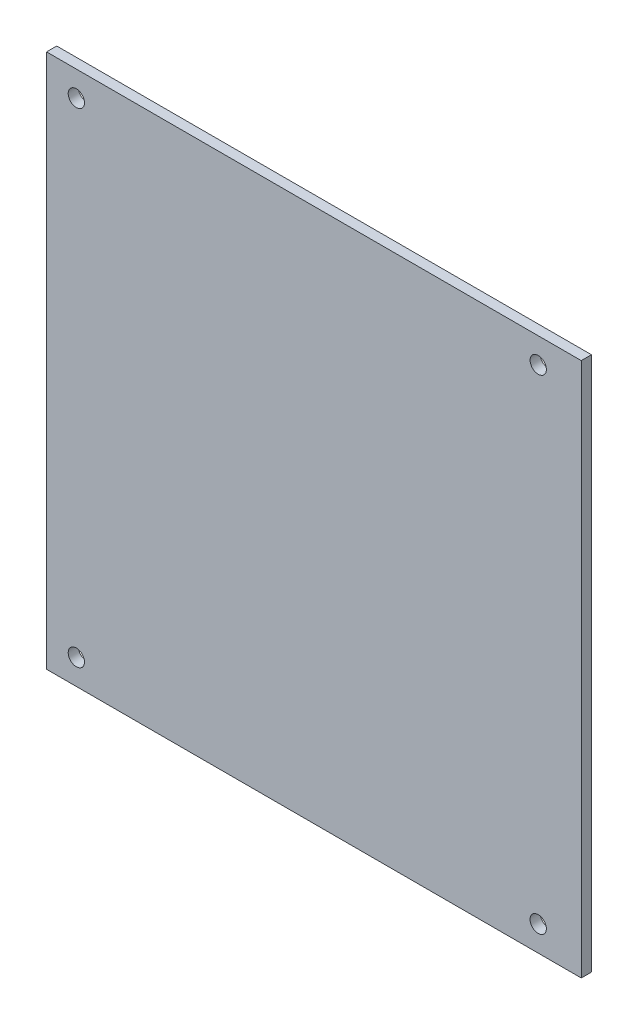
from build123d import *

# Parameters (mm, degrees)
SKETCH_1_R      = 1.6
EXTRUDE_1_DEPTH = 2


with BuildPart() as part:
    # 草图1 → 凸台-拉伸1 (new body)
    with BuildSketch(Plane.XY):
        Polygon((0, 52.5), (52.5, 52.5), (52.5, -52.5), (-52.5, -52.5), (-52.5, 52.5), align=None)
        with Locations((-46.65, 47.55)):
            Circle(SKETCH_1_R, mode=Mode.SUBTRACT)
        with Locations((44.05, 47.55)):
            Circle(SKETCH_1_R, mode=Mode.SUBTRACT)
        with Locations((-46.65, -47.55)):
            Circle(SKETCH_1_R, mode=Mode.SUBTRACT)
        with Locations((44.05, -47.55)):
            Circle(SKETCH_1_R, mode=Mode.SUBTRACT)
    extrude(amount=EXTRUDE_1_DEPTH)


solid = part.part
